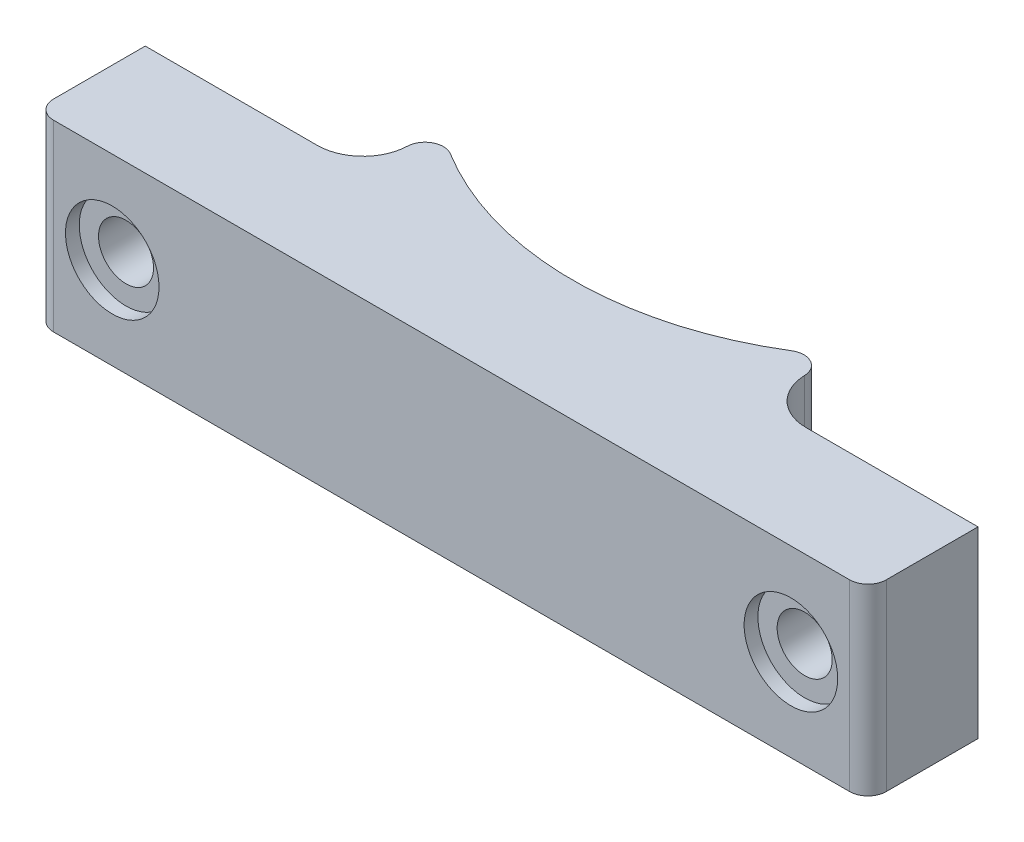
from build123d import *

# Parameters (mm, degrees)
BOSS_EXTRUDE1_DEPTH = 20
FILLET1_R           = 2
HOLE1_D             = 6
HOLE1_DEPTH         = 20.26
HOLE1_CBORE_D       = 10.2
HOLE1_CBORE_DEPTH   = 1.5
HOLE1_TIP           = 1.802581857
FILLET2_R           = 2


with BuildPart() as part:
    # Sketch1 → Boss-Extrude1 (new body)
    with BuildSketch(Plane(origin=(0, 0, 0), x_dir=(1, 0, 0), z_dir=(0, 1, 0))):
        with BuildLine():
            Line((45.4, 0), (-45.4, 0))
            Line((-45.4, 0), (-45.4, 12))
            Line((-45.4, 12), (-26.65, 12))
            ThreePointArc((-26.65, 12), (-23.114466094, 13.464466094), (-21.65, 17))
            Line((-21.65, 17), (-21.65, 20.565901472))
            ThreePointArc((-21.65, 20.565901472), (0, 13.2), (21.65, 20.565901472))
            Line((21.65, 20.565901472), (21.65, 17))
            ThreePointArc((21.65, 17), (23.114466094, 13.464466094), (26.65, 12))
            Line((26.65, 12), (45.4, 12))
            Line((45.4, 12), (45.4, 0))
        make_face()
    extrude(amount=BOSS_EXTRUDE1_DEPTH)

    # Fillet1
    fillet1_edges = [part.edges().sort_by_distance(p)[0] for p in [
        (21.65, 10, -20.565901472),
        (-21.65, 10, -20.565901472),
    ]]
    fillet(fillet1_edges, radius=FILLET1_R)

    # Hole1
    with Locations(Plane.XY):
        with Locations((-37, 10), (37, 10)):
            CounterBoreHole(HOLE1_D / 2, HOLE1_CBORE_D / 2, HOLE1_CBORE_DEPTH, depth=HOLE1_DEPTH)
            with Locations((0, 0, -(HOLE1_DEPTH + HOLE1_TIP / 2))):  # 118° drill point
                Cone(0, HOLE1_D / 2, HOLE1_TIP, mode=Mode.SUBTRACT)

    # Fillet2
    fillet2_edges = [part.edges().sort_by_distance(p)[0] for p in [
        (45.4, 10, 0),
        (-45.4, 10, 0),
    ]]
    fillet(fillet2_edges, radius=FILLET2_R)


solid = part.part
